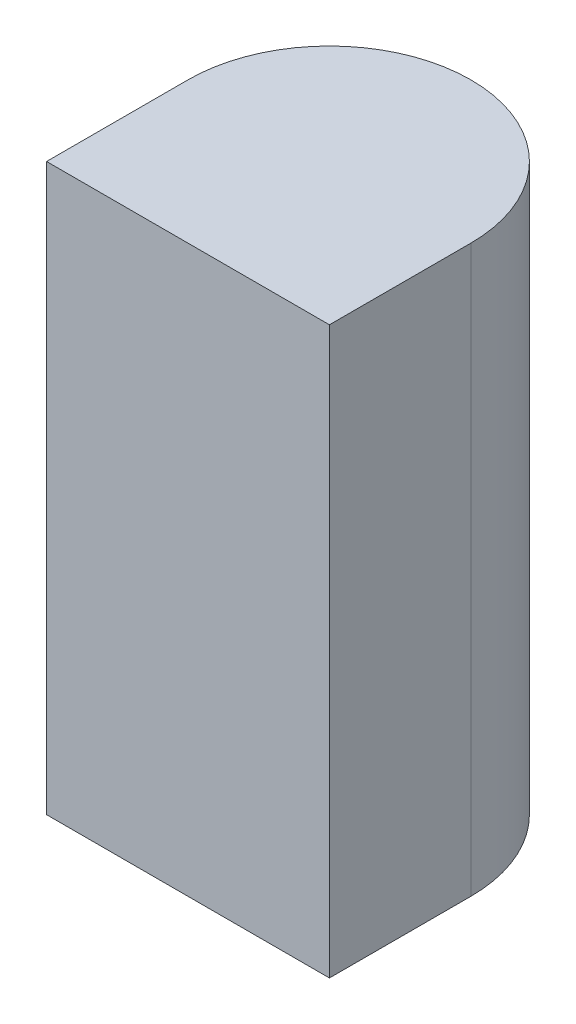
from build123d import *

# Parameters (mm, degrees)
BOSS_EXTRUDE1_DEPTH = 20


with BuildPart() as part:
    # Sketch1 → Boss-Extrude1 (new body)
    with BuildSketch(Plane(origin=(0, 0, 0), x_dir=(1, 0, 0), z_dir=(0, 1, 0))):
        with BuildLine():
            Line((-5, -10), (5, -10))
            Line((5, -10), (5, -5))
            ThreePointArc((5, -5), (0, 0), (-5, -5))
            Line((-5, -5), (-5, -10))
        make_face()
    extrude(amount=BOSS_EXTRUDE1_DEPTH)


solid = part.part
